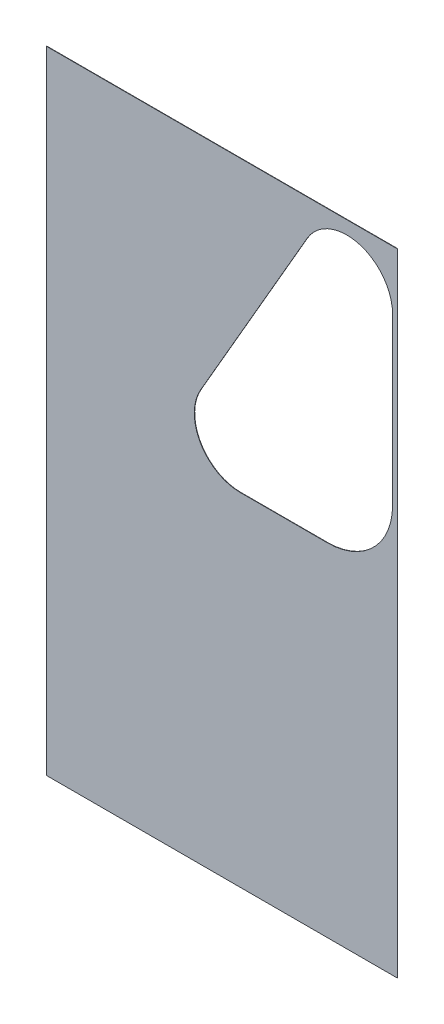
from build123d import *

# Parameters (mm, degrees)
SKETCH1_W           = 903
SKETCH1_H           = 1625
BOSS_EXTRUDE1_DEPTH = 1
CUT_EXTRUDE1_DEPTH  = 1957.486620094


with BuildPart() as part:
    # Sketch1 → Boss-Extrude1 (new body)
    with BuildSketch(Plane.XY):
        with Locations((451.5, 812.5)):
            Rectangle(SKETCH1_W, SKETCH1_H)
    extrude(amount=BOSS_EXTRUDE1_DEPTH)

    # Sketch2 → Cut-Extrude1 (cut, through all)
    with BuildSketch(Plane(origin=(-119.436638294, -43.071405931, 1), x_dir=(1, 0, 0), z_dir=(0, 0, 1))):
        with BuildLine():
            Line((1010.436638294, 1516.071405931), (1010.436638294, 1091.071405931))
            ThreePointArc((1010.436638294, 1091.071405931), (961.230577533, 972.277466691), (842.436638294, 923.071405931))
            Line((842.436638294, 923.071405931), (618.195260429, 923.071405931))
            ThreePointArc((618.195260429, 923.071405931), (516.004262782, 982.071405931), (516.004262782, 1100.071405931))
            Line((516.004262782, 1100.071405931), (790.245640647, 1575.071405931))
            ThreePointArc((790.245640647, 1575.071405931), (922.977285616, 1630.050653433), (1010.436638294, 1516.071405931))
        make_face()
    extrude(amount=-CUT_EXTRUDE1_DEPTH, mode=Mode.SUBTRACT)


solid = part.part
